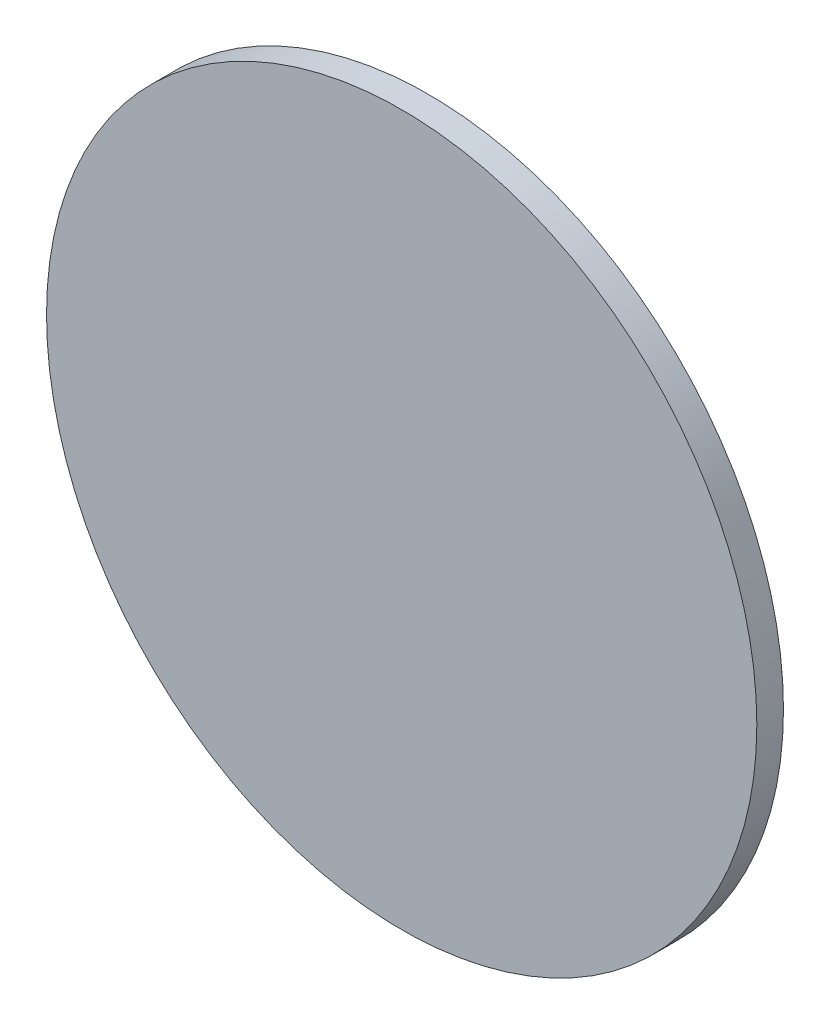
from build123d import *

# Parameters (mm, degrees)
SKETCH1_R           = 50.8
BOSS_EXTRUDE1_DEPTH = 3.81


with BuildPart() as part:
    # Sketch1 → Boss-Extrude1 (new body)
    with BuildSketch(Plane.XY):
        with Locations(Location((0, 0, 0), (0, 0, 180))):
            Circle(SKETCH1_R)
    extrude(amount=BOSS_EXTRUDE1_DEPTH)


solid = part.part
